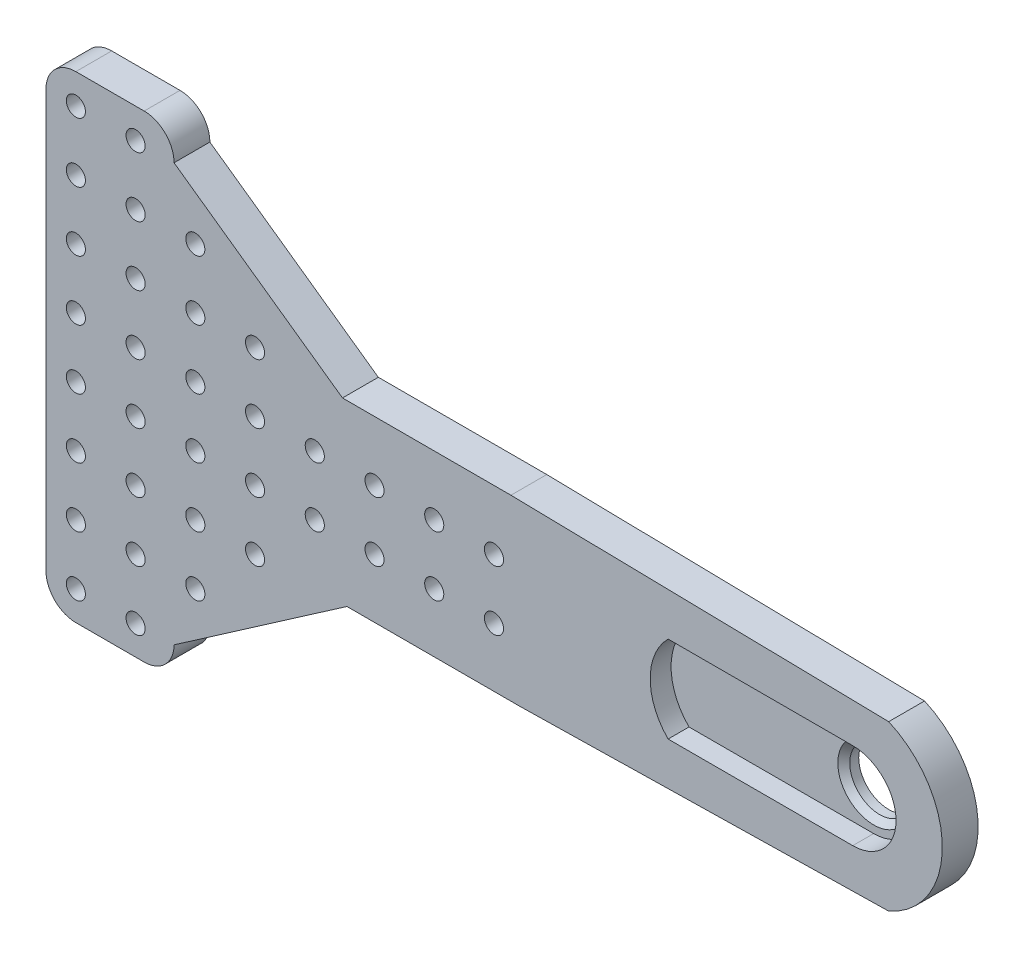
from build123d import *

# Parameters (mm, degrees)
Y_KSEKLIK_EKSTR_ZYON1_DEPTH = 4
KES_EKSTR_ZYON1_START       = -4
KES_EKSTR_ZYON1_DEPTH       = 4
IZIM3_R                     = 5
KES_EKSTR_ZYON2_DEPTH       = 4
KES_EKSTR_ZYON3_DEPTH       = 4
IZIM10_R                    = 7.25
IZIM10_R_2                  = 5
KES_EKSTR_ZYON4_DEPTH       = 3.5
IZIM11_R                    = 5
Y_KSEKLIK_EKSTR_ZYON3_DEPTH = 2
PAH2_SIZE                   = 1
Y_KSEKLIK_EKSTR_ZYON4_DEPTH = 6
Y_KSEKLIK_EKSTR_ZYON5_DEPTH = 6
IZIM14_W                    = 60
IZIM14_H                    = 79.898499323
Y_KSEKLIK_EKSTR_ZYON6_DEPTH = 6
KES_EKSTR_ZYON5_DEPTH       = 11
RADYUS1_R                   = 5
Y_KSEKLIK_EKSTR_ZYON7_DEPTH = 6
KES_EKSTR_ZYON6_DEPTH       = 3.5
IZIM19_R                    = 1.6
KES_EKSTR_ZYON7_DEPTH       = 11


with BuildPart() as part:
    # Çizim1 → Yükseklik-Ekstrüzyon1 (new body)
    with BuildSketch(Plane.XY):
        with BuildLine():
            Line((-35.653037037, 15), (24.346962963, 15))
            ThreePointArc((24.346962963, 15), (39.346962963, 0), (24.346962963, -15))
            Line((24.346962963, -15), (-35.653037037, -15))
            ThreePointArc((-35.653037037, -15), (-50.653037037, 0), (-35.653037037, 15))
        make_face()
    extrude(amount=Y_KSEKLIK_EKSTR_ZYON1_DEPTH)

    # Çizim2 → Kes-Ekstrüzyon1 (cut)
    with BuildSketch(Plane.XY.offset(4).offset(KES_EKSTR_ZYON1_START)):
        Polygon((-11.560212186, 15), (-35.653037037, 15), (-33.243754552, 4.590717515), (-10.375990279, 9.883580305), align=None)
        Polygon((-33.243754552, -4.590717515), (-35.653037037, -15), (-11.560212186, -15), (-10.375990279, -9.883580305), align=None)
        with BuildLine():
            Line((-10.375990279, 9.883580305), (-9.150929701, 4.590717515))
            Line((-9.150929701, 4.590717515), (30.369414779, 13.737906468))
            ThreePointArc((30.369414779, 13.737906468), (27.42360098, 14.681086421), (24.346962963, 15))
            Line((24.346962963, 15), (11.729453249, 15))
            Line((11.729453249, 15), (-10.375990279, 9.883580305))
        make_face()
        with BuildLine():
            Line((-9.150929701, -4.590717515), (-10.375990279, -9.883580305))
            Line((-10.375990279, -9.883580305), (11.729453249, -15))
            Line((11.729453249, -15), (24.346962963, -15))
            ThreePointArc((24.346962963, -15), (27.42360098, -14.681086421), (30.369414779, -13.737906468))
            Line((30.369414779, -13.737906468), (-9.150929701, -4.590717515))
        make_face()
    extrude(amount=KES_EKSTR_ZYON1_DEPTH, mode=Mode.SUBTRACT)


with BuildPart() as kes_ekstr_zyon1_piece_1:
    # of the separate pieces the step leaves, piece 1, a body of its own (kes_ekstr_zyon1_pieces)
    add(part.part.solids().sort_by_distance((-35.653037037, -15, 0))[0])

    # Çizim3 → Kes-Ekstrüzyon2 (cut)
    with BuildSketch(Plane.XY.offset(4)):
        with Locations((24.346962963, 0)):
            Circle(IZIM3_R)
    extrude(amount=-KES_EKSTR_ZYON2_DEPTH, mode=Mode.SUBTRACT)

    # Çizim10 → Kes-Ekstrüzyon4 (cut)
    # profile 1 of 2: a face of its own
    with BuildSketch(Plane.XY.offset(4)):
        with BuildLine():
            ThreePointArc((22.99921211, -7.123627421), (17.102780918, 0.290390243), (23.573735665, 7.20864894))
            Line((23.573735665, 7.20864894), (5.173034472, 5.234919246))
            ThreePointArc((5.173034472, 5.234919246), (0.709580704, 0.698667438), (5.245832511, -3.76478633))
            Line((5.245832511, -3.76478633), (22.99921211, -7.123627421))
        make_face()
    # profile 2 of 2: a face of its own
    with BuildSketch(Plane.XY.offset(4)):
        with Locations((24.346962963, 0)):
            Circle(IZIM10_R)
        with Locations((24.346962963, 0)):
            Circle(IZIM10_R_2, mode=Mode.SUBTRACT)
    extrude(amount=-KES_EKSTR_ZYON4_DEPTH, mode=Mode.SUBTRACT)

    # Çizim11 → Yükseklik-Ekstrüzyon3 (add)
    with BuildSketch(Plane(origin=(0, 0, 0), x_dir=(-1, 0, 0), z_dir=(0, 0, -1))):
        with BuildLine():
            Line((33.243754552, -4.590717515), (35.653037037, -15))
            ThreePointArc((35.653037037, -15), (50.653037037, 0), (35.653037037, 15))
            Line((35.653037037, 15), (33.243754552, 4.590717515))
            Line((33.243754552, 4.590717515), (10.375990279, 9.883580305))
            Line((10.375990279, 9.883580305), (9.150929701, 4.590717515))
            Line((9.150929701, 4.590717515), (-30.369414779, 13.737906468))
            ThreePointArc((-30.369414779, 13.737906468), (-39.346962963, 0), (-30.369414779, -13.737906468))
            Line((-30.369414779, -13.737906468), (9.150929701, -4.590717515))
            Line((9.150929701, -4.590717515), (10.375990279, -9.883580305))
            Line((10.375990279, -9.883580305), (33.243754552, -4.590717515))
        make_face()
        with Locations(Location((-24.346962963, 0, 0), (0, 0, 180))):
            Circle(IZIM11_R, mode=Mode.SUBTRACT)
    extrude(amount=Y_KSEKLIK_EKSTR_ZYON3_DEPTH)

    # Pah2
    pah2_edges = [kes_ekstr_zyon1_piece_1.edges().sort_by_distance(p)[0] for p in [
        (19.346962963, 0, 0.5),
    ]]
    chamfer(pah2_edges, length=PAH2_SIZE)

    # Çizim12 → Yükseklik-Ekstrüzyon4 (add)
    with BuildSketch(Plane.XY.offset(4)):
        Polygon((-35.653037037, 15), (30.369414779, 13.737906468), (-9.150929701, 4.590717515), (-10.375990279, 9.883580305), (-33.243754552, 4.590717515), align=None)
        Polygon((30.369414779, -13.737906468), (-35.653037037, -15), (-33.243754552, -4.590717515), (-10.375990279, -9.883580305), (-9.150929701, -4.590717515), align=None)
    extrude(amount=-Y_KSEKLIK_EKSTR_ZYON4_DEPTH)

    # Çizim13 → Yükseklik-Ekstrüzyon5 (add)
    with BuildSketch(Plane.XY.offset(4)):
        with BuildLine():
            Line((-32.878727884, 14.946965956), (-32.532221989, 34.859974216))
            ThreePointArc((-32.532221989, 34.859974216), (-33.965307671, 38.451608684), (-37.531465176, 39.946965956))
            Line((-37.531465176, 39.946965956), (-45.720483853, 39.946965956))
            ThreePointArc((-45.720483853, 39.946965956), (-49.256017759, 38.482499862), (-50.720483853, 34.946965956))
            Line((-50.720483853, 34.946965956), (-50.720483853, -34.951533367))
            ThreePointArc((-50.720483853, -34.951533367), (-49.256017759, -38.487067273), (-45.720483853, -39.951533367))
            Line((-45.720483853, -39.951533367), (-37.878727884, -39.951533367))
            ThreePointArc((-37.878727884, -39.951533367), (-34.343193978, -38.487067273), (-32.878727884, -34.951533367))
            Line((-32.878727884, -34.951533367), (-32.878727884, 14.946965956))
        make_face()
    extrude(amount=-Y_KSEKLIK_EKSTR_ZYON5_DEPTH)

    # Çizim14 → Yükseklik-Ekstrüzyon6 (add)
    with BuildSketch(Plane.XY.offset(4)):
        with Locations((-80.720483853, -0.002283706)):
            Rectangle(IZIM14_W, IZIM14_H)
    extrude(amount=-Y_KSEKLIK_EKSTR_ZYON6_DEPTH)

    # Çizim15 → Kes-Ekstrüzyon5 (cut)
    with BuildSketch(Plane.XY.offset(4)):
        with BuildLine():
            Line((-89.283153416, 14.946965956), (-32.878727884, 14.946965956))
            Line((-32.878727884, 14.946965956), (-32.532221989, 34.859974216))
            ThreePointArc((-32.532221989, 34.859974216), (-33.965307671, 38.451608684), (-37.531465176, 39.946965956))
            Line((-37.531465176, 39.946965956), (-45.720483853, 39.946965956))
            ThreePointArc((-45.720483853, 39.946965956), (-49.256017759, 38.482499862), (-50.720483853, 34.946965956))
            Line((-50.720483853, 34.946965956), (-50.720483853, 39.946965956))
            Line((-50.720483853, 39.946965956), (-89.283153416, 39.946965956))
            Line((-89.283153416, 39.946965956), (-89.283153416, 14.946965956))
        make_face()
        with BuildLine():
            Line((-32.878727884, -14.946965956), (-31.39257035, -14.91855638))
            Line((-31.39257035, -14.91855638), (-89.283153416, -14.91855638))
            Line((-89.283153416, -14.91855638), (-89.283153416, -39.951533367))
            Line((-89.283153416, -39.951533367), (-50.720483853, -39.951533367))
            Line((-50.720483853, -39.951533367), (-50.720483853, -34.951533367))
            ThreePointArc((-50.720483853, -34.951533367), (-49.256017759, -38.487067273), (-45.720483853, -39.951533367))
            Line((-45.720483853, -39.951533367), (-37.878727884, -39.951533367))
            ThreePointArc((-37.878727884, -39.951533367), (-34.343193978, -38.487067273), (-32.878727884, -34.951533367))
            Line((-32.878727884, -34.951533367), (-32.878727884, -14.946965956))
        make_face()
    extrude(amount=-KES_EKSTR_ZYON5_DEPTH, mode=Mode.SUBTRACT)

    # Radyus1
    radyus1_edges = [kes_ekstr_zyon1_piece_1.edges().sort_by_distance(p)[0] for p in [
        (-110.720483853, 39.946965956, 1),
        (-110.720483853, -39.951533367, 1),
        (-89.283153416, 39.946965956, 1),
        (-89.283153416, -39.951533367, 1),
    ]]
    fillet(radyus1_edges, radius=RADYUS1_R)

    # Çizim17 → Yükseklik-Ekstrüzyon7 (add)
    with BuildSketch(Plane.XY.offset(4)):
        Polygon((-89.283153416, 34.946965956), (-61.08094065, 14.946965956), (-89.283153416, 14.946965956), align=None)
        Polygon((-89.283153416, -34.951533367), (-60.337861883, -14.91855638), (-89.283153416, -14.91855638), align=None)
    extrude(amount=-Y_KSEKLIK_EKSTR_ZYON7_DEPTH)

    # Çizim18 → Kes-Ekstrüzyon6 (cut)
    with BuildSketch(Plane.XY.offset(4)):
        with BuildLine():
            ThreePointArc((23.573735665, 7.20864894), (23.95979686, 7.239654854), (24.346962963, 7.25))
            Line((24.346962963, 7.25), (-6.563606273, 7.25))
            ThreePointArc((-6.563606273, 7.25), (-9.566654601, 0), (-6.563606273, -7.25))
            Line((-6.563606273, -7.25), (24.346962963, -7.25))
            ThreePointArc((24.346962963, -7.25), (23.670131671, -7.218337717), (22.99921211, -7.123627421))
            Line((22.99921211, -7.123627421), (5.245832511, -3.76478633))
            ThreePointArc((5.245832511, -3.76478633), (0.709580704, 0.698667438), (5.173034472, 5.234919246))
            Line((5.173034472, 5.234919246), (23.573735665, 7.20864894))
        make_face()
    extrude(amount=-KES_EKSTR_ZYON6_DEPTH, mode=Mode.SUBTRACT)

    # Çizim19 → Kes-Ekstrüzyon7 (cut)
    with BuildSketch(Plane.XY.offset(4)):
        with Locations((-105.720483853, 34.946965956)):
            Circle(IZIM19_R)
        with Locations((-95.720483853, 34.946965956)):
            Circle(IZIM19_R)
        with Locations((-95.720483853, 24.946965956)):
            Circle(IZIM19_R)
        with Locations((-85.720483853, 24.946965956)):
            Circle(IZIM19_R)
        with Locations((-95.720483853, 14.946965956)):
            Circle(IZIM19_R)
        with Locations((-85.720483853, 14.946965956)):
            Circle(IZIM19_R)
        with Locations((-75.720483853, 14.946965956)):
            Circle(IZIM19_R)
        with Locations((-95.720483853, 4.946965956)):
            Circle(IZIM19_R)
        with Locations((-85.720483853, 4.946965956)):
            Circle(IZIM19_R)
        with Locations((-75.720483853, 4.946965956)):
            Circle(IZIM19_R)
        with Locations((-65.720483853, 4.946965956)):
            Circle(IZIM19_R)
        with Locations((-55.720483853, 4.946965956)):
            Circle(IZIM19_R)
        with Locations((-45.720483853, 4.946965956)):
            Circle(IZIM19_R)
        with Locations((-35.720483853, 4.946965956)):
            Circle(IZIM19_R)
        with Locations((-95.720483853, -5.053034044)):
            Circle(IZIM19_R)
        with Locations((-85.720483853, -5.053034044)):
            Circle(IZIM19_R)
        with Locations((-75.720483853, -5.053034044)):
            Circle(IZIM19_R)
        with Locations((-65.720483853, -5.053034044)):
            Circle(IZIM19_R)
        with Locations((-55.720483853, -5.053034044)):
            Circle(IZIM19_R)
        with Locations((-45.720483853, -5.053034044)):
            Circle(IZIM19_R)
        with Locations((-35.720483853, -5.053034044)):
            Circle(IZIM19_R)
        with Locations((-95.720483853, -15.053034044)):
            Circle(IZIM19_R)
        with Locations((-85.720483853, -15.053034044)):
            Circle(IZIM19_R)
        with Locations((-75.720483853, -15.053034044)):
            Circle(IZIM19_R)
        with Locations((-95.720483853, -25.053034044)):
            Circle(IZIM19_R)
        with Locations((-85.720483853, -25.053034044)):
            Circle(IZIM19_R)
        with Locations((-95.720483853, -35.053034044)):
            Circle(IZIM19_R)
        with Locations((-105.720483853, 24.946965956)):
            Circle(IZIM19_R)
        with Locations((-105.720483853, 14.946965956)):
            Circle(IZIM19_R)
        with Locations((-105.720483853, 4.946965956)):
            Circle(IZIM19_R)
        with Locations((-105.720483853, -5.053034044)):
            Circle(IZIM19_R)
        with Locations((-105.720483853, -15.053034044)):
            Circle(IZIM19_R)
        with Locations((-105.720483853, -25.053034044)):
            Circle(IZIM19_R)
        with Locations((-105.720483853, -35.053034044)):
            Circle(IZIM19_R)
    extrude(amount=-KES_EKSTR_ZYON7_DEPTH, mode=Mode.SUBTRACT)


with BuildPart() as kes_ekstr_zyon1_piece_2:
    # of the separate pieces the step leaves, piece 2, a body of its own (kes_ekstr_zyon1_pieces)
    add(part.part.solids().sort_by_distance((-11.560212186, 15, 0))[0])


with BuildPart() as kes_ekstr_zyon1_piece_3:
    # of the separate pieces the step leaves, piece 3, a body of its own (kes_ekstr_zyon1_pieces)
    add(part.part.solids().sort_by_distance((11.729453249, -15, 0))[0])


with BuildPart() as kes_ekstr_zyon3_tool:
    # Çizim5 → Kes-Ekstrüzyon3 (new body)
    with BuildSketch(Plane.XY.offset(4)):
        Polygon((-10.375990279, -9.883580305), (-11.560212186, -15), (11.729453249, -15), align=None)
        Polygon((-11.560212186, 15), (-10.375990279, 9.883580305), (11.729453249, 15), align=None)
    extrude(amount=-KES_EKSTR_ZYON3_DEPTH)


with BuildPart() as kes_ekstr_zyon1_piece_2_1:
    add(kes_ekstr_zyon1_piece_2.part)

    # Kes-Ekstrüzyon3: cut by kes_ekstr_zyon3_tool
    add(kes_ekstr_zyon3_tool.part, mode=Mode.SUBTRACT)


with BuildPart() as kes_ekstr_zyon1_piece_3_1:
    add(kes_ekstr_zyon1_piece_3.part)

    # Kes-Ekstrüzyon3: cut by kes_ekstr_zyon3_tool
    add(kes_ekstr_zyon3_tool.part, mode=Mode.SUBTRACT)


solid = kes_ekstr_zyon1_piece_1.part
